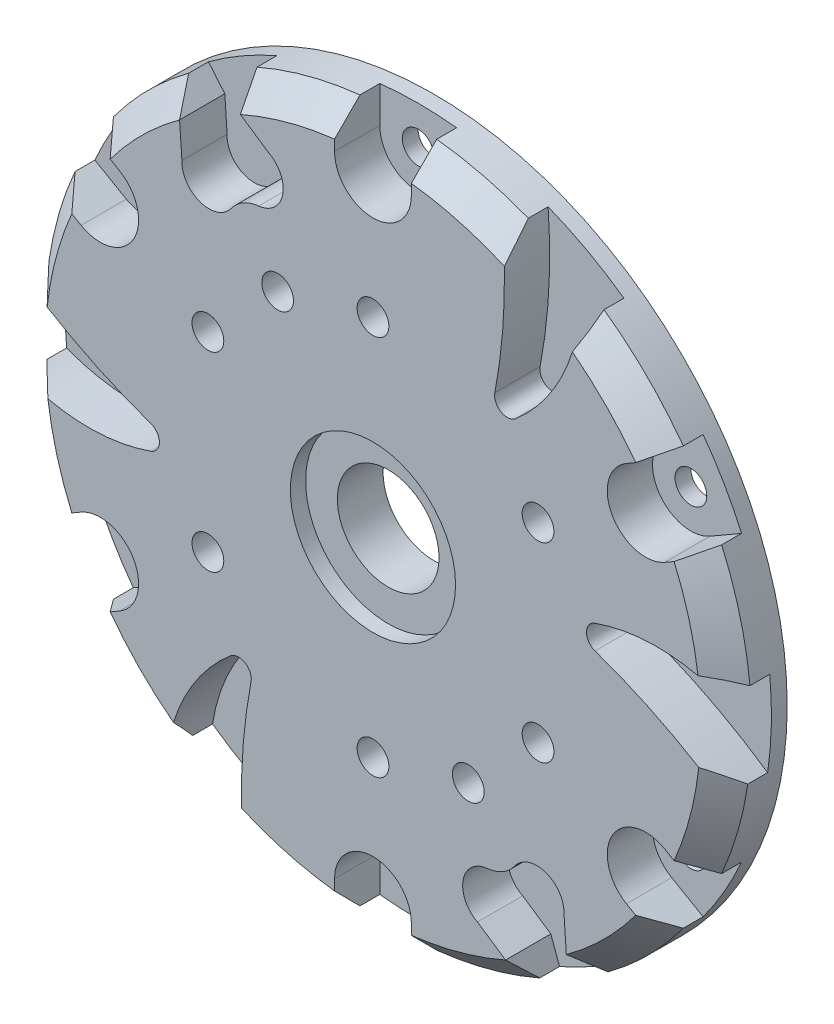
from build123d import *

# Parameters (mm, degrees)
SKETCH1_R             = 27.8
BOSS_EXTRUDE1_DEPTH   = 4.8
CHAMFER1_SIZE         = 2
CUT_EXTRUDE1_START    = -3.56
CUT_EXTRUDE1_DEPTH    = 3.56
M3X0_5_TAPPED_HOLE1_D = 2.5
SKETCH7_R             = 4
CUT_EXTRUDE2_DEPTH    = 40.607070076
SKETCH8_R             = 6.5
CUT_EXTRUDE3_DEPTH    = 1.2
M3X0_5_TAPPED_HOLE2_D = 2.5


with BuildPart() as part:
    # Sketch1 → Boss-Extrude1 (new body)
    with BuildSketch(Plane.XY):
        Circle(SKETCH1_R)
    extrude(amount=BOSS_EXTRUDE1_DEPTH)

    # Chamfer1
    chamfer1_edges = [part.edges().sort_by_distance(p)[0] for p in [
        (-27.8, 0, 4.8),
    ]]
    chamfer(chamfer1_edges, length=CHAMFER1_SIZE)

    # Sketch2 → Cut-Extrude1 (cut)
    with BuildSketch(Plane.XY.offset(4.8).offset(CUT_EXTRUDE1_START)):
        with BuildLine():
            Line((-3.02, 27.635477199), (-3.02, 24.78))
            ThreePointArc((-3.02, 24.78), (0, 21.76), (3.02, 24.78))
            Line((3.02, 24.78), (3.02, 27.635477199))
            ThreePointArc((3.02, 27.635477199), (0, 27.8), (-3.02, 27.635477199))
        make_face()
        with BuildLine():
            Line((22.4230253, 16.433135319), (19.950109506, 15.005396719))
            ThreePointArc((19.950109506, 15.005396719), (18.844712786, 10.88), (22.970109506, 9.774603281))
            Line((22.970109506, 9.774603281), (25.4430253, 11.20234188))
            ThreePointArc((25.4430253, 11.20234188), (24.075506225, 13.9), (22.4230253, 16.433135319))
        make_face()
        with BuildLine():
            Line((25.4430253, -11.20234188), (22.970109506, -9.774603281))
            ThreePointArc((22.970109506, -9.774603281), (18.844712786, -10.88), (19.950109506, -15.005396719))
            Line((19.950109506, -15.005396719), (22.4230253, -16.433135319))
            ThreePointArc((22.4230253, -16.433135319), (24.075506225, -13.9), (25.4430253, -11.20234188))
        make_face()
        with BuildLine():
            Line((3.02, -27.635477199), (3.02, -24.78))
            ThreePointArc((3.02, -24.78), (0, -21.76), (-3.02, -24.78))
            Line((-3.02, -24.78), (-3.02, -27.635477199))
            ThreePointArc((-3.02, -27.635477199), (0, -27.8), (3.02, -27.635477199))
        make_face()
        with BuildLine():
            Line((-22.4230253, -16.433135319), (-19.950109506, -15.005396719))
            ThreePointArc((-19.950109506, -15.005396719), (-18.844712786, -10.88), (-22.970109506, -9.774603281))
            Line((-22.970109506, -9.774603281), (-25.4430253, -11.20234188))
            ThreePointArc((-25.4430253, -11.20234188), (-24.075506225, -13.9), (-22.4230253, -16.433135319))
        make_face()
        with BuildLine():
            Line((-25.4430253, 11.20234188), (-22.970109506, 9.774603281))
            ThreePointArc((-22.970109506, 9.774603281), (-18.844712786, 10.88), (-19.950109506, 15.005396719))
            Line((-19.950109506, 15.005396719), (-22.4230253, 16.433135319))
            ThreePointArc((-22.4230253, 16.433135319), (-24.075506225, 13.9), (-25.4430253, 11.20234188))
        make_face()
        with BuildLine():
            ThreePointArc((-8.990760958, 18.077325331), (-7.097001538, 19.802867047), (-8.218352654, 22.106427471))
            Line((-8.218352654, 22.106427471), (-10.434772365, 23.595667519))
            Line((-10.434772365, 23.595667519), (-11.326579695, 26.037938541))
            ThreePointArc((-11.326579695, 26.037938541), (-14.197408663, 24.590633141), (-16.886226391, 22.828075024))
            Line((-16.886226391, 22.828075024), (-15.217061308, 20.834611711))
            Line((-15.217061308, 20.834611711), (-15.035551449, 18.170515911))
            ThreePointArc((-15.035551449, 18.170515911), (-13.601285161, 16.047617146), (-11.16004249, 16.824890055))
            ThreePointArc((-11.16004249, 16.824890055), (-10.211194098, 17.686306984), (-8.990760958, 18.077325331))
        make_face()
        with BuildLine():
            ThreePointArc((8.990760958, -18.077325331), (7.097001538, -19.802867047), (8.218352654, -22.106427471))
            Line((8.218352654, -22.106427471), (10.434772365, -23.595667519))
            Line((10.434772365, -23.595667519), (11.326579695, -26.037938541))
            ThreePointArc((11.326579695, -26.037938541), (14.197408663, -24.590633141), (16.886226391, -22.828075024))
            Line((16.886226391, -22.828075024), (15.217061308, -20.834611711))
            Line((15.217061308, -20.834611711), (15.035551449, -18.170515911))
            ThreePointArc((15.035551449, -18.170515911), (13.601285161, -16.047617146), (11.16004249, -16.824890055))
            ThreePointArc((11.16004249, -16.824890055), (10.211194098, -17.686306984), (8.990760958, -18.077325331))
        make_face()
        with BuildLine():
            ThreePointArc((9.592925481, 14.639879042), (10.072666849, 13.587453118), (11.224576406, 13.691647537))
            ThreePointArc((11.224576406, 13.691647537), (14.666706062, 17.996812228), (16.27190214, 23.26995599))
            ThreePointArc((16.27190214, 23.26995599), (13.319162757, 25.077191918), (10.168440088, 26.511666813))
            ThreePointArc((10.168440088, 26.511666813), (10.298392669, 20.555523396), (9.592925481, 14.639879042))
        make_face()
        with BuildLine():
            ThreePointArc((28.288324102, 2.456902626), (22.919049608, 3.703333926), (17.46960279, 2.874944546))
            ThreePointArc((17.46960279, 2.874944546), (16.803412997, 1.929458816), (17.474969899, 0.987777643))
            ThreePointArc((17.474969899, 0.987777643), (22.950801784, -1.359092028), (28.043997001, -4.449705973))
            ThreePointArc((28.043997001, -4.449705973), (28.377066635, -1.003862654), (28.288324102, 2.456902626))
        make_face()
        with BuildLine():
            ThreePointArc((-28.288324102, -2.456902626), (-22.919049608, -3.703333926), (-17.46960279, -2.874944546))
            ThreePointArc((-17.46960279, -2.874944546), (-16.803412997, -1.929458816), (-17.474969899, -0.987777643))
            ThreePointArc((-17.474969899, -0.987777643), (-22.950801784, 1.359092028), (-28.043997001, 4.449705973))
            ThreePointArc((-28.043997001, 4.449705973), (-28.377066635, 1.003862654), (-28.288324102, -2.456902626))
        make_face()
        with BuildLine():
            ThreePointArc((-10.168440088, -26.511666813), (-10.298392669, -20.555523396), (-9.592925481, -14.639879042))
            ThreePointArc((-9.592925481, -14.639879042), (-10.072666849, -13.587453118), (-11.224576406, -13.691647537))
            ThreePointArc((-11.224576406, -13.691647537), (-14.666706062, -17.996812228), (-16.27190214, -23.26995599))
            ThreePointArc((-16.27190214, -23.26995599), (-13.319162757, -25.077191918), (-10.168440088, -26.511666813))
        make_face()
    extrude(amount=CUT_EXTRUDE1_DEPTH, mode=Mode.SUBTRACT)

    # M3x0.5 Tapped Hole1 (through all)
    with Locations(Plane.XY.offset(4.8)):
        with Locations((0, 15), (12.990881057, 7.500866025), (12.991881057, -7.499133975), (7.501866025, -12.989881057), (0.002, -15), (-12.988881057, -7.500866025), (-12.989881057, 7.499133975), (-7.499866025, 12.989881057)):
            Hole(M3X0_5_TAPPED_HOLE1_D / 2)

    # Sketch7 → Cut-Extrude2 (cut, through all)
    with BuildSketch(Plane.XY.offset(4.8)):
        Circle(SKETCH7_R)
    extrude(amount=-CUT_EXTRUDE2_DEPTH, mode=Mode.SUBTRACT)

    # Sketch8 → Cut-Extrude3 (cut)
    with BuildSketch(Plane.XY.offset(4.8)):
        Circle(SKETCH8_R)
    extrude(amount=-CUT_EXTRUDE3_DEPTH, mode=Mode.SUBTRACT)

    # M3x0.5 Tapped Hole2 (through all)
    with Locations(Plane.XY.offset(4.8)):
        with Locations((0, 24.78), (21.460109506, 12.39), (21.460109506, -12.39), (0, -24.78), (-21.460109506, -12.39), (-21.460109506, 12.39), (0, 0)):
            Hole(M3X0_5_TAPPED_HOLE2_D / 2)


solid = part.part
